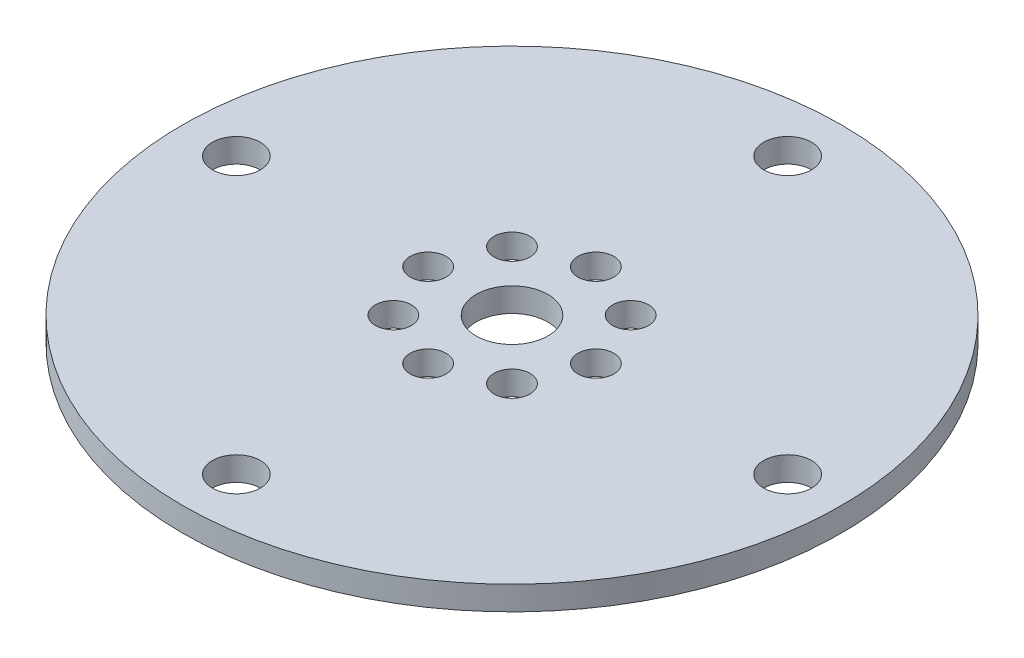
from build123d import *

# Parameters (mm, degrees)
SKETCH_1_R      = 27.5
SKETCH_1_R_2    = 1.5
SKETCH_1_R_3    = 3
SKETCH_1_R_4    = 2
EXTRUDE_1_DEPTH = 2


with BuildPart() as part:
    # 草图1 → 凸台-拉伸1 (new body)
    with BuildSketch(Plane(origin=(0, 0, 0), x_dir=(1, 0, 0), z_dir=(0, 1, 0))):
        with Locations(Location((0, 0, 0), (0, 0, 270))):
            Circle(SKETCH_1_R)
        with Locations(Location((0, 7, 0), (0, 0, 270))):
            Circle(SKETCH_1_R_2, mode=Mode.SUBTRACT)
        with Locations(Location((4.949747468, 4.949747468, 0), (0, 0, 270))):
            Circle(SKETCH_1_R_2, mode=Mode.SUBTRACT)
        with Locations(Location((7, 0, 0), (0, 0, 270))):
            Circle(SKETCH_1_R_2, mode=Mode.SUBTRACT)
        with Locations(Location((4.949747468, -4.949747468, 0), (0, 0, 270))):
            Circle(SKETCH_1_R_2, mode=Mode.SUBTRACT)
        with Locations(Location((0, -7, 0), (0, 0, 270))):
            Circle(SKETCH_1_R_2, mode=Mode.SUBTRACT)
        with Locations(Location((-4.949747468, -4.949747468, 0), (0, 0, 270))):
            Circle(SKETCH_1_R_2, mode=Mode.SUBTRACT)
        with Locations(Location((-7, 0, 0), (0, 0, 270))):
            Circle(SKETCH_1_R_2, mode=Mode.SUBTRACT)
        with Locations(Location((-4.949747468, 4.949747468, 0), (0, 0, 270))):
            Circle(SKETCH_1_R_2, mode=Mode.SUBTRACT)
        with Locations(Location((0, 0, 0), (0, 0, 270))):
            Circle(SKETCH_1_R_3, mode=Mode.SUBTRACT)
        with Locations(Location((0, 23, 0), (0, 0, 270))):
            Circle(SKETCH_1_R_4, mode=Mode.SUBTRACT)
        with Locations(Location((23, 0, 0), (0, 0, 270))):
            Circle(SKETCH_1_R_4, mode=Mode.SUBTRACT)
        with Locations(Location((0, -23, 0), (0, 0, 270))):
            Circle(SKETCH_1_R_4, mode=Mode.SUBTRACT)
        with Locations(Location((-23, 0, 0), (0, 0, 270))):
            Circle(SKETCH_1_R_4, mode=Mode.SUBTRACT)
    extrude(amount=EXTRUDE_1_DEPTH)


solid = part.part
